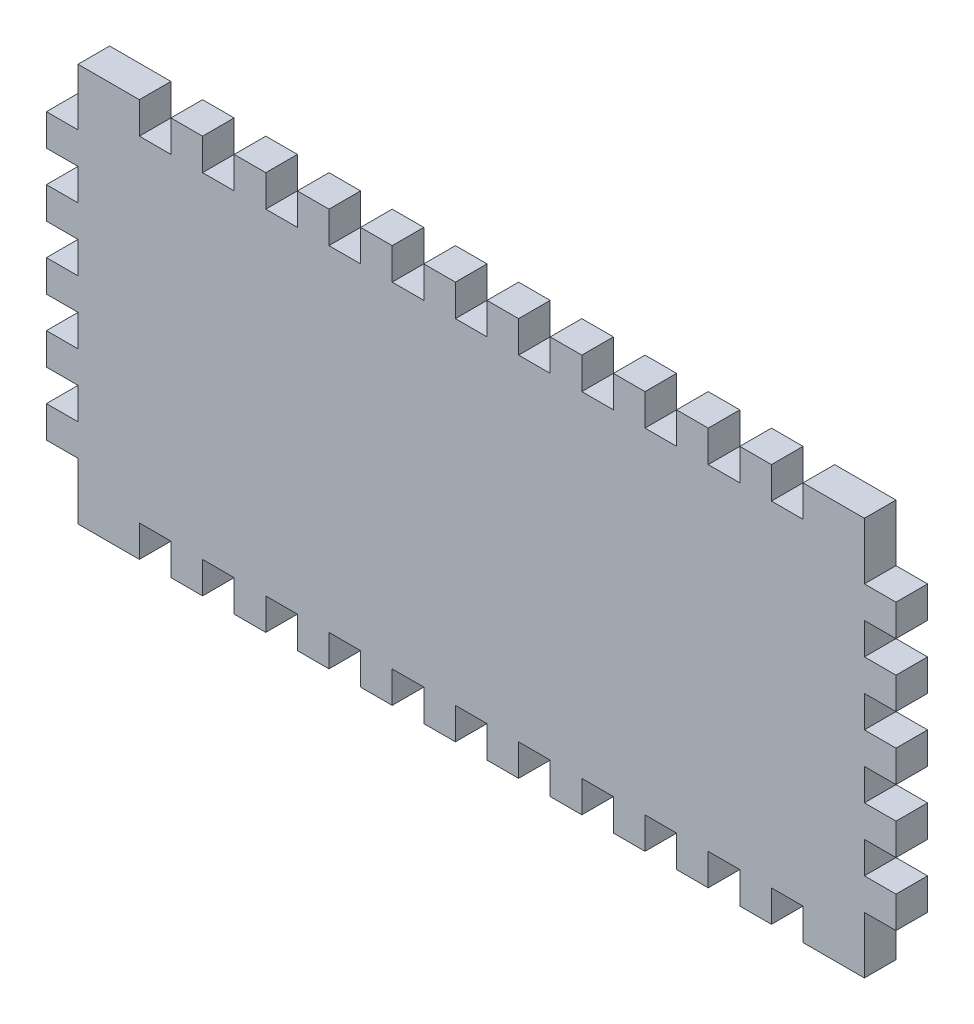
from build123d import *

# Parameters (mm, degrees)
SKETCH1_W                     = 79
SKETCH1_H                     = 40
BOSS_EXTRUDE1_DEPTH           = 3.175
SKETCH2_W                     = 3.175
SKETCH2_H                     = 6.35
CUT_EXTRUDE1_DEPTH            = 10
LPATTERN1_COUNT               = 6
LPATTERN1_PITCH               = 6.35
LPATTERN1_COPY_1_SKETCH_W     = 3.175
LPATTERN1_COPY_1_SKETCH_H     = 6.35
LPATTERN1_COPY_1_DEPTH        = 10
LPATTERN1_COPY_2_SKETCH_W     = 3.175
LPATTERN1_COPY_2_SKETCH_H     = 6.35
LPATTERN1_COPY_2_DEPTH        = 10
LPATTERN1_COPY_3_SKETCH_W     = 3.175
LPATTERN1_COPY_3_SKETCH_H     = 6.35
LPATTERN1_COPY_3_DEPTH        = 10
LPATTERN1_COPY_4_SKETCH_W     = 3.175
LPATTERN1_COPY_4_SKETCH_H     = 6.35
LPATTERN1_COPY_4_DEPTH        = 10
LPATTERN1_COPY_5_SKETCH_W     = 3.175
LPATTERN1_COPY_5_SKETCH_H     = 6.35
LPATTERN1_COPY_5_DEPTH        = 10
LPATTERN1_COL_COUNT           = 6
LPATTERN1_COL_PITCH           = 6.35
LPATTERN1_COL_COPY_1_SKETCH_W = 3.175
LPATTERN1_COL_COPY_1_SKETCH_H = 6.35
LPATTERN1_COL_COPY_1_DEPTH    = 10
LPATTERN1_COL_COPY_2_SKETCH_W = 3.175
LPATTERN1_COL_COPY_2_SKETCH_H = 6.35
LPATTERN1_COL_COPY_2_DEPTH    = 10
LPATTERN1_COL_COPY_3_SKETCH_W = 3.175
LPATTERN1_COL_COPY_3_SKETCH_H = 6.35
LPATTERN1_COL_COPY_3_DEPTH    = 10
LPATTERN1_COL_COPY_4_SKETCH_W = 3.175
LPATTERN1_COL_COPY_4_SKETCH_H = 6.35
LPATTERN1_COL_COPY_4_DEPTH    = 10
LPATTERN1_COL_COPY_5_SKETCH_W = 3.175
LPATTERN1_COL_COPY_5_SKETCH_H = 6.35
LPATTERN1_COL_COPY_5_DEPTH    = 10
SKETCH3_W                     = 6.35
SKETCH3_H                     = 3.175
BOSS_EXTRUDE2_DEPTH           = 3.175
LPATTERN2_COUNT               = 3
LPATTERN2_PITCH               = 6.35
LPATTERN2_COL_COUNT           = 3
LPATTERN2_COL_PITCH           = 6.35
MIRROR2_COPY_1_SKETCH_W       = 6.35
MIRROR2_COPY_1_SKETCH_H       = 3.175
MIRROR2_COPY_1_DEPTH          = 3.175
MIRROR2_COPY_2_SKETCH_W       = 6.35
MIRROR2_COPY_2_SKETCH_H       = 3.175
MIRROR2_COPY_2_DEPTH          = 3.175
MIRROR2_COPY_3_SKETCH_W       = 6.35
MIRROR2_COPY_3_SKETCH_H       = 3.175
MIRROR2_COPY_3_DEPTH          = 3.175
MIRROR2_COPY_4_SKETCH_W       = 6.35
MIRROR2_COPY_4_SKETCH_H       = 3.175
MIRROR2_COPY_4_DEPTH          = 3.175


with BuildPart() as part:
    # Sketch1 → Boss-Extrude1 (new body)
    with BuildSketch(Plane.XY):
        Rectangle(SKETCH1_W, SKETCH1_H)
    extrude(amount=BOSS_EXTRUDE1_DEPTH)

    # Sketch2 → Cut-Extrude1 (cut)
    with BuildSketch(Plane.XY.offset(3.175)):
        with Locations((0, -20)):
            Rectangle(SKETCH2_W, SKETCH2_H)
    cut_extrude1 = extrude(amount=-CUT_EXTRUDE1_DEPTH, mode=Mode.SUBTRACT)

    # Mirror1: Cut-Extrude1 across plane
    add(cut_extrude1.mirror(Plane.ZX), mode=Mode.SUBTRACT)

    # LPattern1: Cut-Extrude1 ×6
    with Locations(*[(i * LPATTERN1_PITCH, 0, 0) for i in range(1, LPATTERN1_COUNT)]):
        add(cut_extrude1, mode=Mode.SUBTRACT)

    # LPattern1 copy 1 sketch → LPattern1 copy 1 (cut)
    with BuildSketch(Plane(origin=(6.35, 0, 3.175), x_dir=(1, 0, 0), z_dir=(0, 0, 1))):
        with Locations((0, 20)):
            Rectangle(LPATTERN1_COPY_1_SKETCH_W, LPATTERN1_COPY_1_SKETCH_H)
    extrude(amount=-LPATTERN1_COPY_1_DEPTH, mode=Mode.SUBTRACT)

    # LPattern1 copy 2 sketch → LPattern1 copy 2 (cut)
    with BuildSketch(Plane(origin=(12.7, 0, 3.175), x_dir=(1, 0, 0), z_dir=(0, 0, 1))):
        with Locations((0, 20)):
            Rectangle(LPATTERN1_COPY_2_SKETCH_W, LPATTERN1_COPY_2_SKETCH_H)
    extrude(amount=-LPATTERN1_COPY_2_DEPTH, mode=Mode.SUBTRACT)

    # LPattern1 copy 3 sketch → LPattern1 copy 3 (cut)
    with BuildSketch(Plane(origin=(19.05, 0, 3.175), x_dir=(1, 0, 0), z_dir=(0, 0, 1))):
        with Locations((0, 20)):
            Rectangle(LPATTERN1_COPY_3_SKETCH_W, LPATTERN1_COPY_3_SKETCH_H)
    extrude(amount=-LPATTERN1_COPY_3_DEPTH, mode=Mode.SUBTRACT)

    # LPattern1 copy 4 sketch → LPattern1 copy 4 (cut)
    with BuildSketch(Plane(origin=(25.4, 0, 3.175), x_dir=(1, 0, 0), z_dir=(0, 0, 1))):
        with Locations((0, 20)):
            Rectangle(LPATTERN1_COPY_4_SKETCH_W, LPATTERN1_COPY_4_SKETCH_H)
    extrude(amount=-LPATTERN1_COPY_4_DEPTH, mode=Mode.SUBTRACT)

    # LPattern1 copy 5 sketch → LPattern1 copy 5 (cut)
    with BuildSketch(Plane(origin=(31.75, 0, 3.175), x_dir=(1, 0, 0), z_dir=(0, 0, 1))):
        with Locations((0, 20)):
            Rectangle(LPATTERN1_COPY_5_SKETCH_W, LPATTERN1_COPY_5_SKETCH_H)
    extrude(amount=-LPATTERN1_COPY_5_DEPTH, mode=Mode.SUBTRACT)

    # LPattern1 col: Cut-Extrude1 ×6
    with Locations(*[(-i * LPATTERN1_COL_PITCH, 0, 0) for i in range(1, LPATTERN1_COL_COUNT)]):
        add(cut_extrude1, mode=Mode.SUBTRACT)

    # LPattern1 col copy 1 sketch → LPattern1 col copy 1 (cut)
    with BuildSketch(Plane(origin=(-6.35, 0, 3.175), x_dir=(1, 0, 0), z_dir=(0, 0, 1))):
        with Locations((0, 20)):
            Rectangle(LPATTERN1_COL_COPY_1_SKETCH_W, LPATTERN1_COL_COPY_1_SKETCH_H)
    extrude(amount=-LPATTERN1_COL_COPY_1_DEPTH, mode=Mode.SUBTRACT)

    # LPattern1 col copy 2 sketch → LPattern1 col copy 2 (cut)
    with BuildSketch(Plane(origin=(-12.7, 0, 3.175), x_dir=(1, 0, 0), z_dir=(0, 0, 1))):
        with Locations((0, 20)):
            Rectangle(LPATTERN1_COL_COPY_2_SKETCH_W, LPATTERN1_COL_COPY_2_SKETCH_H)
    extrude(amount=-LPATTERN1_COL_COPY_2_DEPTH, mode=Mode.SUBTRACT)

    # LPattern1 col copy 3 sketch → LPattern1 col copy 3 (cut)
    with BuildSketch(Plane(origin=(-19.05, 0, 3.175), x_dir=(1, 0, 0), z_dir=(0, 0, 1))):
        with Locations((0, 20)):
            Rectangle(LPATTERN1_COL_COPY_3_SKETCH_W, LPATTERN1_COL_COPY_3_SKETCH_H)
    extrude(amount=-LPATTERN1_COL_COPY_3_DEPTH, mode=Mode.SUBTRACT)

    # LPattern1 col copy 4 sketch → LPattern1 col copy 4 (cut)
    with BuildSketch(Plane(origin=(-25.4, 0, 3.175), x_dir=(1, 0, 0), z_dir=(0, 0, 1))):
        with Locations((0, 20)):
            Rectangle(LPATTERN1_COL_COPY_4_SKETCH_W, LPATTERN1_COL_COPY_4_SKETCH_H)
    extrude(amount=-LPATTERN1_COL_COPY_4_DEPTH, mode=Mode.SUBTRACT)

    # LPattern1 col copy 5 sketch → LPattern1 col copy 5 (cut)
    with BuildSketch(Plane(origin=(-31.75, 0, 3.175), x_dir=(1, 0, 0), z_dir=(0, 0, 1))):
        with Locations((0, 20)):
            Rectangle(LPATTERN1_COL_COPY_5_SKETCH_W, LPATTERN1_COL_COPY_5_SKETCH_H)
    extrude(amount=-LPATTERN1_COL_COPY_5_DEPTH, mode=Mode.SUBTRACT)

    # Sketch3 → Boss-Extrude2 (add)
    with BuildSketch(Plane.XY.offset(3.175)):
        with Locations((-39.5, 0)):
            Rectangle(SKETCH3_W, SKETCH3_H)
    boss_extrude2 = extrude(amount=-BOSS_EXTRUDE2_DEPTH)

    # LPattern2: Boss-Extrude2 ×3
    with Locations(*[(0, i * LPATTERN2_PITCH, 0) for i in range(1, LPATTERN2_COUNT)]):
        add(boss_extrude2)

    # LPattern2 col: Boss-Extrude2 ×3
    with Locations(*[(0, -i * LPATTERN2_COL_PITCH, 0) for i in range(1, LPATTERN2_COL_COUNT)]):
        add(boss_extrude2)

    # Mirror2: Boss-Extrude2 across plane
    add(boss_extrude2.mirror(Plane(origin=(0, 0, 0), x_dir=(0, 0, 1), z_dir=(1, 0, 0))))

    # Mirror2 copy 1 sketch → Mirror2 copy 1 (add)
    with BuildSketch(Plane(origin=(0, 6.35, 3.175), x_dir=(-1, 0, 0), z_dir=(0, 0, 1))):
        with Locations((-39.5, 0)):
            Rectangle(MIRROR2_COPY_1_SKETCH_W, MIRROR2_COPY_1_SKETCH_H)
    extrude(amount=-MIRROR2_COPY_1_DEPTH)

    # Mirror2 copy 2 sketch → Mirror2 copy 2 (add)
    with BuildSketch(Plane(origin=(0, 12.7, 3.175), x_dir=(-1, 0, 0), z_dir=(0, 0, 1))):
        with Locations((-39.5, 0)):
            Rectangle(MIRROR2_COPY_2_SKETCH_W, MIRROR2_COPY_2_SKETCH_H)
    extrude(amount=-MIRROR2_COPY_2_DEPTH)

    # Mirror2 copy 3 sketch → Mirror2 copy 3 (add)
    with BuildSketch(Plane(origin=(0, -6.35, 3.175), x_dir=(-1, 0, 0), z_dir=(0, 0, 1))):
        with Locations((-39.5, 0)):
            Rectangle(MIRROR2_COPY_3_SKETCH_W, MIRROR2_COPY_3_SKETCH_H)
    extrude(amount=-MIRROR2_COPY_3_DEPTH)

    # Mirror2 copy 4 sketch → Mirror2 copy 4 (add)
    with BuildSketch(Plane(origin=(0, -12.7, 3.175), x_dir=(-1, 0, 0), z_dir=(0, 0, 1))):
        with Locations((-39.5, 0)):
            Rectangle(MIRROR2_COPY_4_SKETCH_W, MIRROR2_COPY_4_SKETCH_H)
    extrude(amount=-MIRROR2_COPY_4_DEPTH)


solid = part.part
